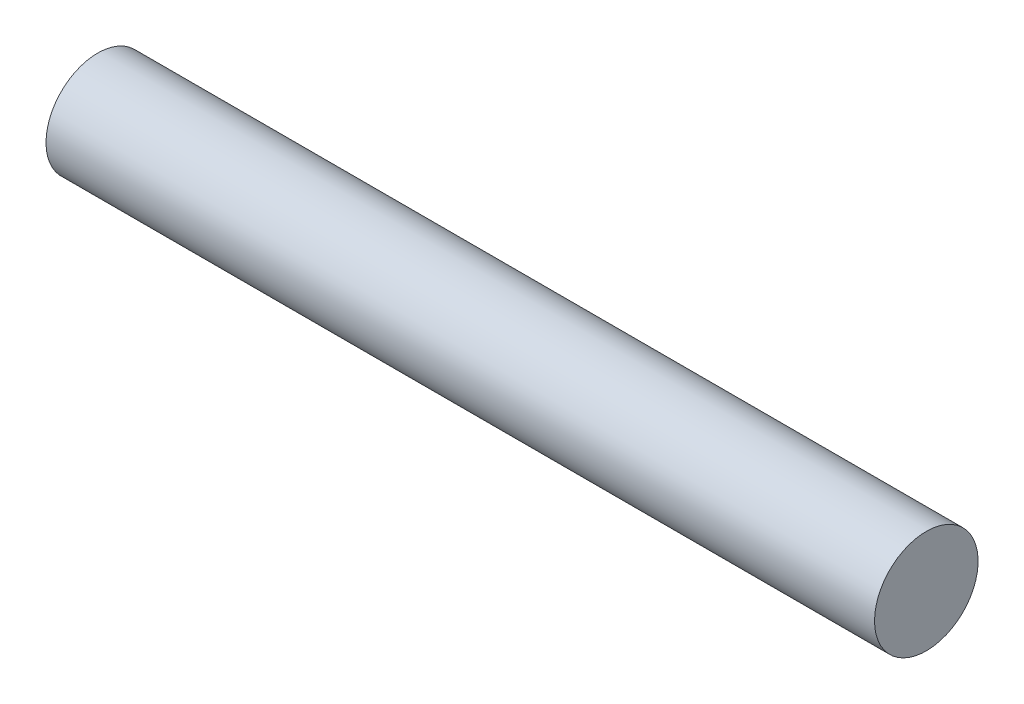
from build123d import *

# Parameters (mm, degrees)
CROQUIS1_R              = 2.38125
SALIENTE_EXTRUIR1_DEPTH = 19.05


with BuildPart() as part:
    # Croquis1 → Saliente-Extruir1 (new, symmetric)
    with BuildSketch(Plane(origin=(0, 0, 0), x_dir=(0, 0, -1), z_dir=(1, 0, 0))):
        with Locations(Location((0, 0, 0), (0, 0, 180))):
            Circle(CROQUIS1_R)
    extrude(amount=SALIENTE_EXTRUIR1_DEPTH, both=True)


solid = part.part
